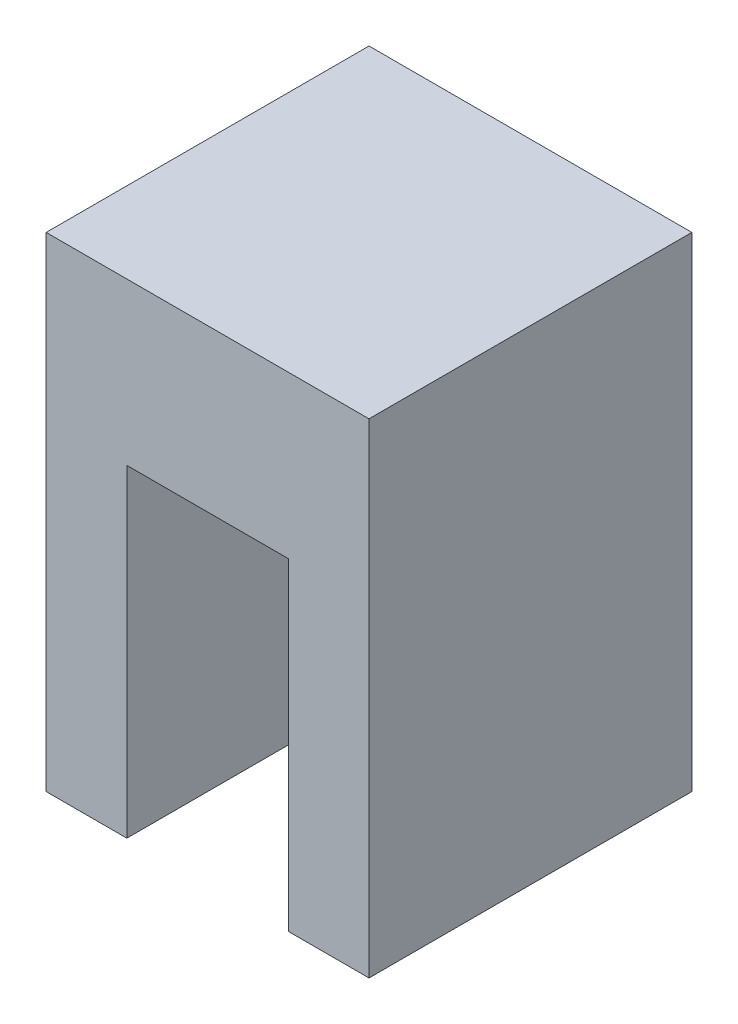
from build123d import *

# Parameters (mm, degrees)
EXTRUDE_1_DEPTH = 20


with BuildPart() as part:
    # 草图1 → 凸台-拉伸1 (new body)
    with BuildSketch(Plane.XY):
        Polygon((0, 14.132569968), (20, 14.132569968), (20, -15.867430032), (15, -15.867430032), (15, 4.132569968), (5, 4.132569968), (5, -15.867430032), (0, -15.867430032), align=None)
    extrude(amount=EXTRUDE_1_DEPTH)


solid = part.part
